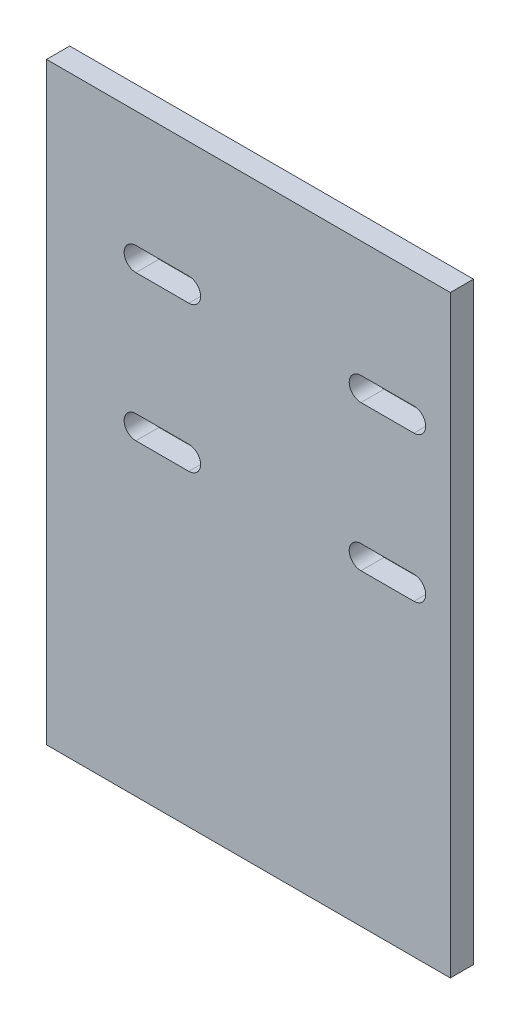
from build123d import *

# Parameters (mm, degrees)
BOSS_EXTRUDE1_START = 20.333687
BOSS_EXTRUDE1_DEPTH = 11.1125


with BuildPart() as part:
    # Sketch1 → Boss-Extrude1 (new body)
    with BuildSketch(Plane.XY.offset(BOSS_EXTRUDE1_START)):
        Polygon((293.574186737, -297.8658), (293.574186737, -310.5658), (99.899186737, -310.5658), (99.899186737, -297.8658), (99.899186737, -25.8475), (293.574186737, -25.8475), align=None)
        with BuildLine():
            ThreePointArc((250.711686737, -151.555275), (245.076061737, -157.1909), (250.711686737, -162.826525))
            Line((250.711686737, -162.826525), (276.111686737, -162.826525))
            ThreePointArc((276.111686737, -162.826525), (281.747311737, -157.1909), (276.111686737, -151.555275))
            Line((276.111686737, -151.555275), (250.711686737, -151.555275))
        make_face(mode=Mode.SUBTRACT)
        with BuildLine():
            ThreePointArc((250.711686737, -81.705275), (245.076061737, -87.3409), (250.711686737, -92.976525))
            Line((250.711686737, -92.976525), (276.111686737, -92.976525))
            ThreePointArc((276.111686737, -92.976525), (281.747311737, -87.3409), (276.111686737, -81.705275))
            Line((276.111686737, -81.705275), (250.711686737, -81.705275))
        make_face(mode=Mode.SUBTRACT)
        with BuildLine():
            ThreePointArc((168.161686737, -92.976525), (173.797311737, -87.3409), (168.161686737, -81.705275))
            Line((168.161686737, -81.705275), (142.761686737, -81.705275))
            ThreePointArc((142.761686737, -81.705275), (137.126061737, -87.3409), (142.761686737, -92.976525))
            Line((142.761686737, -92.976525), (168.161686737, -92.976525))
        make_face(mode=Mode.SUBTRACT)
        with BuildLine():
            ThreePointArc((142.761686737, -151.555275), (137.126061737, -157.1909), (142.761686737, -162.826525))
            Line((142.761686737, -162.826525), (168.161686737, -162.826525))
            ThreePointArc((168.161686737, -162.826525), (173.797311737, -157.1909), (168.161686737, -151.555275))
            Line((168.161686737, -151.555275), (142.761686737, -151.555275))
        make_face(mode=Mode.SUBTRACT)
    extrude(amount=BOSS_EXTRUDE1_DEPTH)


solid = part.part
